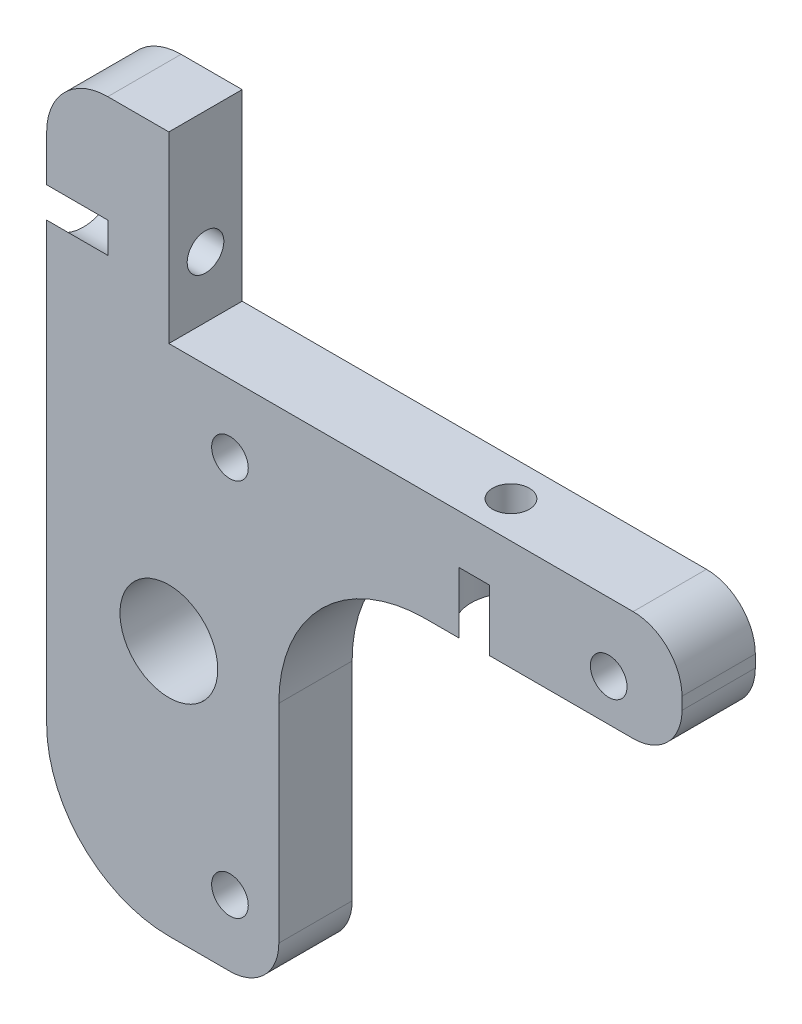
from build123d import *

# Parameters (mm, degrees)
CROQUIS1_R              = 1.5
CROQUIS1_R_2            = 4
SALIENTE_EXTRUIR1_DEPTH = 6
CROQUIS4_R              = 1.5
CORTAR_EXTRUIR3_DEPTH   = 54.749418602
CROQUIS5_R              = 1.5
CORTAR_EXTRUIR4_DEPTH   = 68.111846942
CROQUIS6_R              = 3.25
CORTAR_EXTRUIR5_DEPTH   = 5
CROQUIS7_R              = 3.25
CORTAR_EXTRUIR6_DEPTH   = 5


with BuildPart() as part:
    # Croquis1 → Saliente-Extruir1 (new body)
    with BuildSketch(Plane.XY):
        with BuildLine():
            Line((0, 0), (38, 0))
            ThreePointArc((38, 0), (40.828427125, -1.171572875), (42, -4))
            Line((42, -4), (42, -5))
            ThreePointArc((42, -5), (40.828427125, -7.828427125), (38, -9))
            Line((38, -9), (21, -9))
            ThreePointArc((21, -9), (12.514718626, -12.514718626), (9, -21))
            Line((9, -21), (9, -38))
            ThreePointArc((9, -38), (7.828427125, -40.828427125), (5, -42))
            Line((5, -42), (0, -42))
            ThreePointArc((0, -42), (-7.071067812, -39.071067812), (-10, -32))
            Line((-10, -32), (-10, 10))
            ThreePointArc((-10, 10), (-8.535533906, 13.535533906), (-5, 15))
            Line((-5, 15), (0, 15))
            Line((0, 15), (0, 0))
        make_face()
        with Locations((36, -5.58)):
            Circle(CROQUIS1_R, mode=Mode.SUBTRACT)
        with Locations((5, -5.58)):
            Circle(CROQUIS1_R, mode=Mode.SUBTRACT)
        with Locations((5, -36.58)):
            Circle(CROQUIS1_R, mode=Mode.SUBTRACT)
        with Locations((0, -21.1)):
            Circle(CROQUIS1_R_2, mode=Mode.SUBTRACT)
    extrude(amount=SALIENTE_EXTRUIR1_DEPTH)

    # Croquis4 → Cortar-Extruir3 (cut, through all)
    with BuildSketch(Plane.XZ.offset(9)):
        with Locations((25, 3)):
            Circle(CROQUIS4_R)
    extrude(amount=-CORTAR_EXTRUIR3_DEPTH, mode=Mode.SUBTRACT)

    # Croquis5 → Cortar-Extruir4 (cut, through all)
    with BuildSketch(Plane.ZY.offset(10)):
        with Locations((3, 5)):
            Circle(CROQUIS5_R)
    extrude(amount=-CORTAR_EXTRUIR4_DEPTH, mode=Mode.SUBTRACT)

    # Croquis6 → Cortar-Extruir5 (cut)
    with BuildSketch(Plane.XZ.offset(9)):
        with Locations((25, 3)):
            Circle(CROQUIS6_R)
    extrude(amount=-CORTAR_EXTRUIR5_DEPTH, mode=Mode.SUBTRACT)

    # Croquis7 → Cortar-Extruir6 (cut)
    with BuildSketch(Plane.ZY.offset(10)):
        with Locations((3, 5)):
            Circle(CROQUIS7_R)
    extrude(amount=-CORTAR_EXTRUIR6_DEPTH, mode=Mode.SUBTRACT)


solid = part.part
